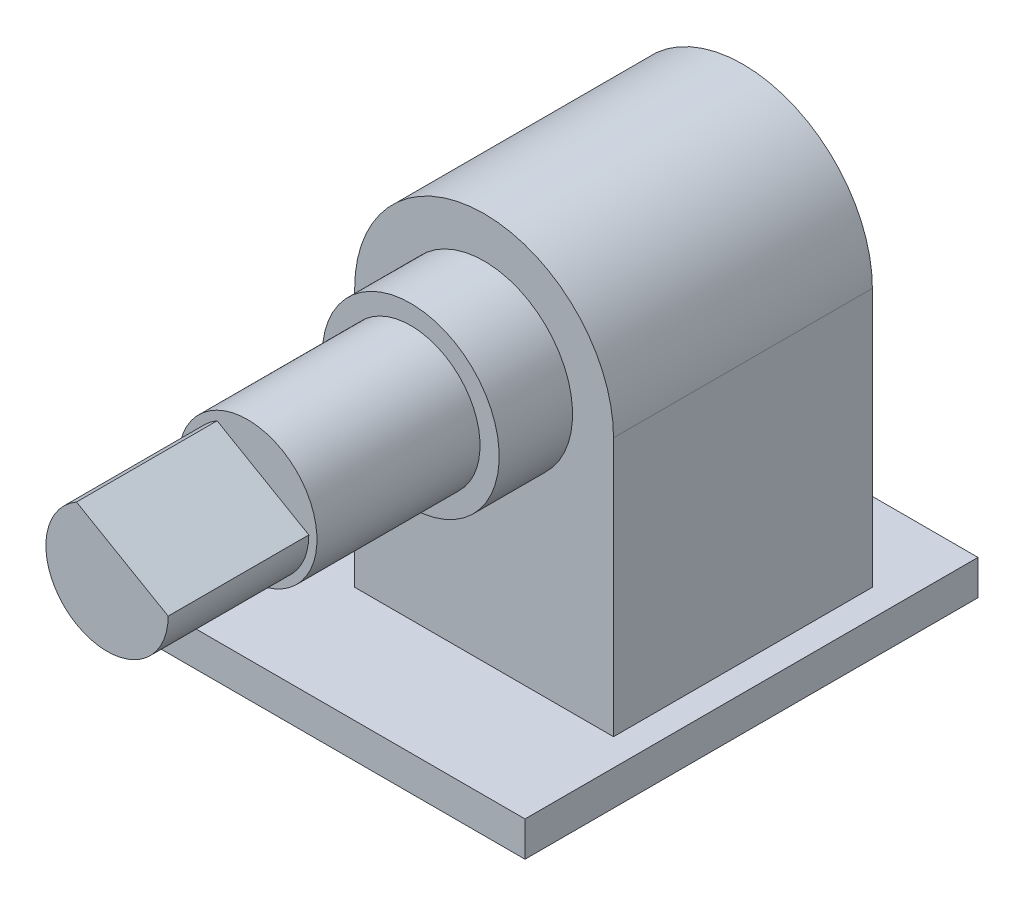
from build123d import *

# Parameters (mm, degrees)
SKETCH1_W           = 19.304
SKETCH1_H           = 22.225
BOSS_EXTRUDE1_DEPTH = 1.7145
SKETCH2_W           = 12.7
SKETCH2_H           = 12.7
BOSS_EXTRUDE2_DEPTH = 19.05
FILLET1_RADIUS      = 6.35
FILLET1_LENGTH      = 12.7
CUT_EXTRUDE1_START  = -6.9
CUT_EXTRUDE1_DEPTH  = 6.9


with BuildPart() as part:
    # Sketch1 → Boss-Extrude1 (new body)
    with BuildSketch(Plane(origin=(0, 0, 0), x_dir=(1, 0, 0), z_dir=(0, 1, 0))):
        Rectangle(SKETCH1_W, SKETCH1_H)
    extrude(amount=BOSS_EXTRUDE1_DEPTH)

    # Sketch2 → Boss-Extrude2 (add)
    with BuildSketch(Plane(origin=(0, 1.7145, 0), x_dir=(1, 0, 0), z_dir=(0, 1, 0))):
        with Locations((1.9812, 0.9017)):
            Rectangle(SKETCH2_W, SKETCH2_H)
    extrude(amount=BOSS_EXTRUDE2_DEPTH)

    # Fillet1: full round fillet: the end face becomes a half cylinder, R = half its width
    fillet1_face = Plane((1.9812, 20.7645, -0.9017), x_dir=(0, 0, 1), z_dir=(0, 1, 0))  # on the end face: x along it, z out of the body
    fillet1_slab = fillet1_face.offset(-FILLET1_RADIUS / 2) * Box(FILLET1_LENGTH, 2 * FILLET1_RADIUS, FILLET1_RADIUS, mode=Mode.PRIVATE)  # the body's end, R deep
    fillet1_round = Plane((1.9812, 14.4145, -0.9017), x_dir=(0, 1, 0), z_dir=(0, 0, 1)) * Cylinder(FILLET1_RADIUS, FILLET1_LENGTH, mode=Mode.PRIVATE)  # its axis R under the face
    add(fillet1_slab - fillet1_round, mode=Mode.SUBTRACT)

    # Sketch6 → Revolve1 (revolve)
    with BuildSketch(Plane(origin=(0, 14.4145, 0), x_dir=(1, 0, 0), z_dir=(0, 1, 0))):
        Polygon((1.9812, -23.9483), (-1.0188, -23.9483), (-1.0188, -17.0483), (-1.4188, -17.0483), (-1.4188, -9.0483), (-2.3588, -9.0483), (-2.3588, -5.4483), (1.9812, -5.4483), align=None)
    revolve(axis=Axis((1.9812, 14.4145, 5.4483), (0, 0, 1)))

    # Sketch7 → Cut-Extrude1 (cut)
    with BuildSketch(Plane.XY.offset(23.9483).offset(CUT_EXTRUDE1_START)):
        with BuildLine():
            Line((0.4812, 17.012576211), (4.9812, 14.4145))
            ThreePointArc((4.9812, 14.4145), (3.4812, 17.012576211), (0.4812, 17.012576211))
        make_face()
    extrude(amount=CUT_EXTRUDE1_DEPTH, mode=Mode.SUBTRACT)


solid = part.part
